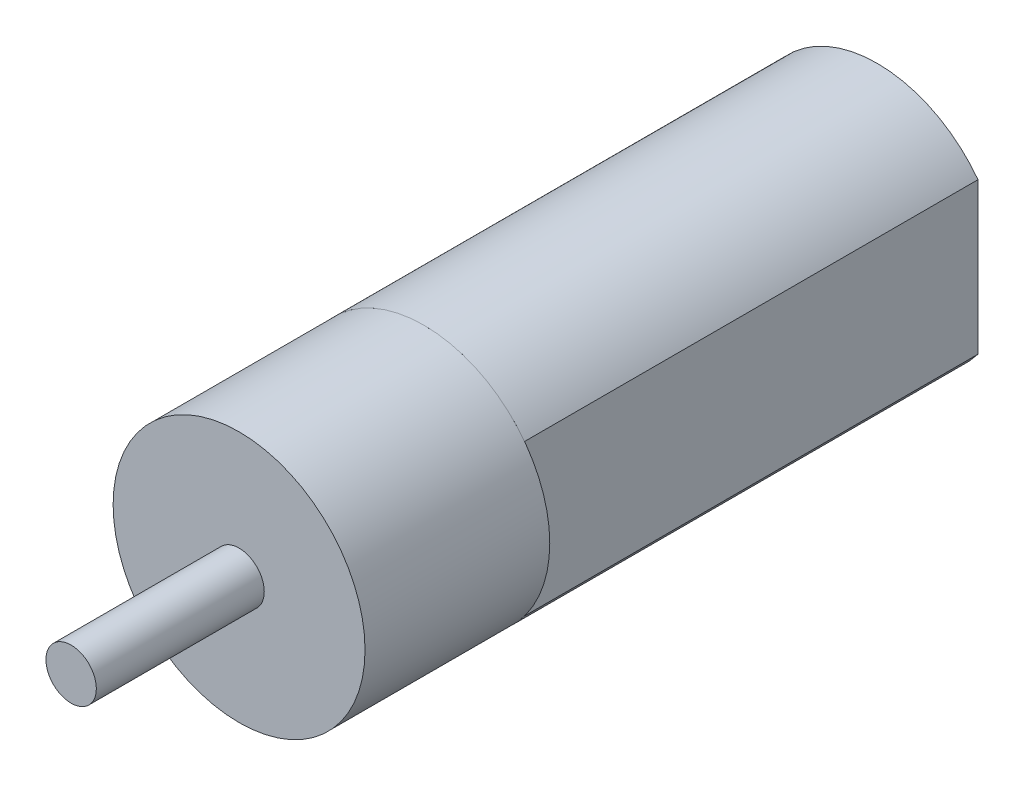
from build123d import *

# Parameters (mm, degrees)
CROQUIS1_R              = 7.5
SALIENTE_EXTRUIR1_DEPTH = 11
CROQUIS2_R              = 1.5
SALIENTE_EXTRUIR2_DEPTH = 10
SALIENTE_EXTRUIR3_DEPTH = 27


with BuildPart() as part:
    # Croquis1 → Saliente-Extruir1 (new body)
    with BuildSketch(Plane.XY):
        Circle(CROQUIS1_R)
    extrude(amount=SALIENTE_EXTRUIR1_DEPTH)

    # Croquis2 → Saliente-Extruir2 (add)
    with BuildSketch(Plane.XY.offset(11)):
        Circle(CROQUIS2_R)
    extrude(amount=SALIENTE_EXTRUIR2_DEPTH)


with BuildPart() as body_2:
    # Croquis3 → Saliente-Extruir3 (new body)
    with BuildSketch(Plane(origin=(0, 0, 0), x_dir=(-1, 0, 0), z_dir=(0, 0, -1))):
        with BuildLine():
            Line((-6, 4.5), (-6, -4.5))
            ThreePointArc((-6, -4.5), (0, -7.5), (6, -4.5))
            Line((6, -4.5), (6, 4.5))
            ThreePointArc((6, 4.5), (0, 7.5), (-6, 4.5))
        make_face()
    extrude(amount=SALIENTE_EXTRUIR3_DEPTH)


solid = Compound([part.part, body_2.part])
